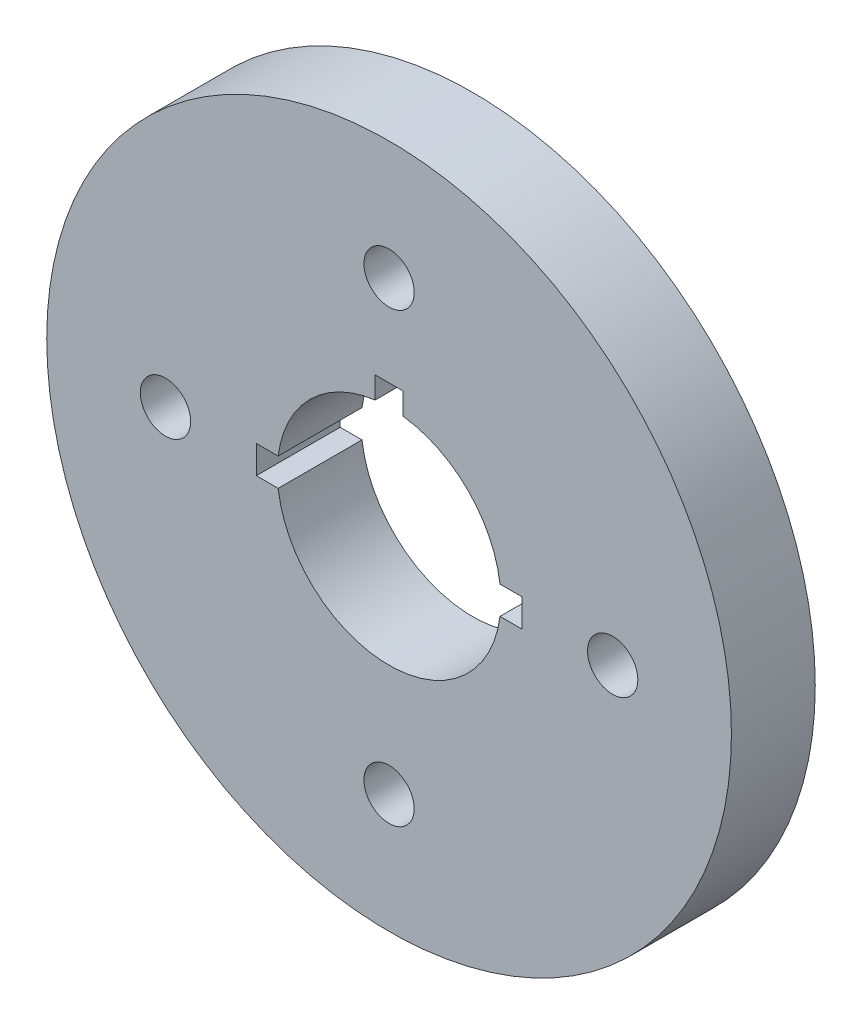
from build123d import *

# Parameters (mm, degrees)
BOSS_EXTRUDE1_DEPTH = 3
CUT_EXTRUDE1_START  = -3
CUT_EXTRUDE1_DEPTH  = 3
SKETCH5_R           = 0.9
CUT_EXTRUDE2_DEPTH  = 3


with BuildPart() as part:
    # Sketch1 → Boss-Extrude1 (new body)
    with BuildSketch(Plane.XY):
        with BuildLine():
            ThreePointArc((4, 0), (2.747276725, -2.907313295), (-0.226235298, -3.993597074))
            Line((-0.226235298, -3.993597074), (-0.6928456, -12.230391039))
            ThreePointArc((-0.6928456, -12.230391039), (8.41353497, -8.903646966), (12.25, 0))
            ThreePointArc((12.25, 0), (-5.47503582, 10.958397819), (-7.35595637, -9.795529893))
            Line((-7.35595637, -9.795529893), (-2.401944937, -3.198540373))
            ThreePointArc((-2.401944937, -3.198540373), (-1.787766798, 3.578252349), (4, 0))
        make_face()
        with BuildLine():
            Line((-0.6928456, -12.230391039), (-0.226235298, -3.993597074))
            ThreePointArc((-0.226235298, -3.993597074), (-1.372902628, -3.757011894), (-2.401944937, -3.198540373))
            Line((-2.401944937, -3.198540373), (-7.35595637, -9.795529893))
            ThreePointArc((-7.35595637, -9.795529893), (-4.204514299, -11.505848926), (-0.6928456, -12.230391039))
        make_face()
        with BuildLine():
            Line((-0.226235298, -3.993597074), (-0.6928456, -12.230391039))
            ThreePointArc((-0.6928456, -12.230391039), (4.204514299, 11.505848926), (-7.35595637, -9.795529893))
            Line((-7.35595637, -9.795529893), (-2.401944937, -3.198540373))
            ThreePointArc((-2.401944937, -3.198540373), (1.372902628, 3.757011894), (-0.226235298, -3.993597074))
        make_face()
    extrude(amount=BOSS_EXTRUDE1_DEPTH)

    # Sketch2 → Cut-Extrude1 (cut)
    with BuildSketch(Plane.XY.offset(3).offset(CUT_EXTRUDE1_START)):
        with BuildLine():
            Line((-3.968626967, 0.5), (-4.75, 0.5))
            Line((-4.75, 0.5), (-4.75, -0.5))
            Line((-4.75, -0.5), (-3.968626967, -0.5))
            ThreePointArc((-3.968626967, -0.5), (-4, 0), (-3.968626967, 0.5))
        make_face()
        with BuildLine():
            Line((-0.5, 4.75), (-0.5, 3.968626967))
            ThreePointArc((-0.5, 3.968626967), (0, 4), (0.5, 3.968626967))
            Line((0.5, 3.968626967), (0.5, 4.75))
            Line((0.5, 4.75), (-0.5, 4.75))
        make_face()
        with BuildLine():
            ThreePointArc((3.968626967, 0.5), (4, 0), (3.968626967, -0.5))
            Line((3.968626967, -0.5), (4.75, -0.5))
            Line((4.75, -0.5), (4.75, 0.5))
            Line((4.75, 0.5), (3.968626967, 0.5))
        make_face()
    extrude(amount=CUT_EXTRUDE1_DEPTH, mode=Mode.SUBTRACT)

    # Sketch5 → Cut-Extrude2 (cut)
    with BuildSketch(Plane.XY.offset(3)):
        with Locations((0, -8)):
            Circle(SKETCH5_R)
        with Locations((-8, 0)):
            Circle(SKETCH5_R)
        with Locations((0, 8)):
            Circle(SKETCH5_R)
        with Locations((8, 0)):
            Circle(SKETCH5_R)
    extrude(amount=-CUT_EXTRUDE2_DEPTH, mode=Mode.SUBTRACT)


solid = part.part
